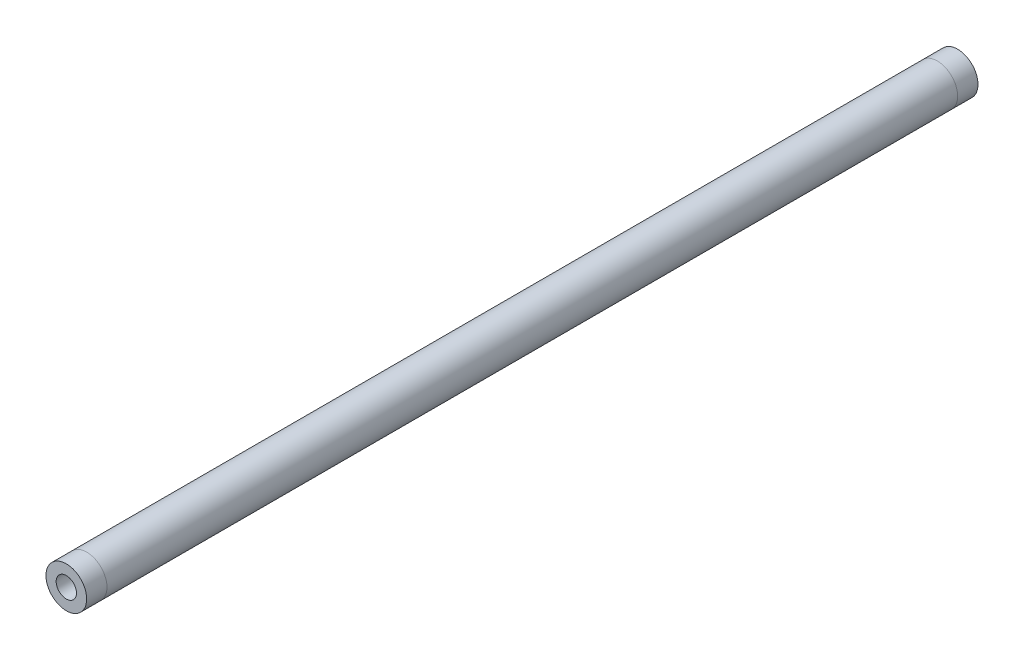
from build123d import *

# Parameters (mm, degrees)
THREADED_START            = -21.9075
SKETCH2_R                 = 6.35
SKETCH2_R_2               = 4.7625
SKETCH2_R_3               = 3.175
THREADED_INSERT_1_1_DEPTH = 6.35
THREADED_START_2          = -28.2575
SKETCH2_5_R               = 4.7625
SKETCH2_5_R_2             = 3.175
THREADED_INSERT_1_2_DEPTH = 9.525
BOSS_EXTRUDE4_START       = -300.081848
SKETCH2_7_R               = 6.35
SKETCH2_7_R_2             = 4.7625
SKETCH2_7_R_3             = 3.175
BOSS_EXTRUDE4_DEPTH       = 6.35
BOSS_EXTRUDE5_START       = -284.206848
SKETCH2_8_R               = 4.7625
SKETCH2_8_R_2             = 3.175
BOSS_EXTRUDE5_DEPTH       = 9.525
BOSS_EXTRUDE6_START       = -28.2575
SKETCH2_9_R               = 6.35
SKETCH2_9_R_2             = 4.7625
BOSS_EXTRUDE6_DEPTH       = 265.4743484


with BuildPart() as part:
    # Sketch2 → Threaded Insert 1-1 (new body)
    # profile 1 of 2: a face of its own
    with BuildSketch(Plane.XY.offset(THREADED_START)):
        Circle(SKETCH2_R)
        Circle(SKETCH2_R_2, mode=Mode.SUBTRACT)
    # profile 2 of 2: a face of its own
    with BuildSketch(Plane.XY.offset(THREADED_START)):
        Circle(SKETCH2_R_2)
        Circle(SKETCH2_R_3, mode=Mode.SUBTRACT)
    extrude(amount=-THREADED_INSERT_1_1_DEPTH)

    # Sketch2<5> → Threaded Insert 1-2 (add)
    with BuildSketch(Plane.XY.offset(THREADED_START_2)):
        Circle(SKETCH2_5_R)
        Circle(SKETCH2_5_R_2, mode=Mode.SUBTRACT)
    extrude(amount=-THREADED_INSERT_1_2_DEPTH)


with BuildPart() as body_2:
    # Sketch2<7> → Boss-Extrude4 (new body)
    # profile 1 of 2: a face of its own
    with BuildSketch(Plane.XY.offset(BOSS_EXTRUDE4_START)):
        Circle(SKETCH2_7_R)
        Circle(SKETCH2_7_R_2, mode=Mode.SUBTRACT)
    # profile 2 of 2: a face of its own
    with BuildSketch(Plane.XY.offset(BOSS_EXTRUDE4_START)):
        Circle(SKETCH2_7_R_2)
        Circle(SKETCH2_7_R_3, mode=Mode.SUBTRACT)
    extrude(amount=BOSS_EXTRUDE4_DEPTH)

    # Sketch2<8> → Boss-Extrude5 (add)
    with BuildSketch(Plane.XY.offset(BOSS_EXTRUDE5_START)):
        with Locations(Location((0, 0, 0), (0, 0, 180))):
            Circle(SKETCH2_8_R)
        Circle(SKETCH2_8_R_2, mode=Mode.SUBTRACT)
    extrude(amount=-BOSS_EXTRUDE5_DEPTH)


with BuildPart() as body_3:
    # Sketch2<9> → Boss-Extrude6 (new body)
    with BuildSketch(Plane.XY.offset(BOSS_EXTRUDE6_START)):
        Circle(SKETCH2_9_R)
        Circle(SKETCH2_9_R_2, mode=Mode.SUBTRACT)
    extrude(amount=-BOSS_EXTRUDE6_DEPTH)


solid = Compound([part.part, body_2.part, body_3.part])
